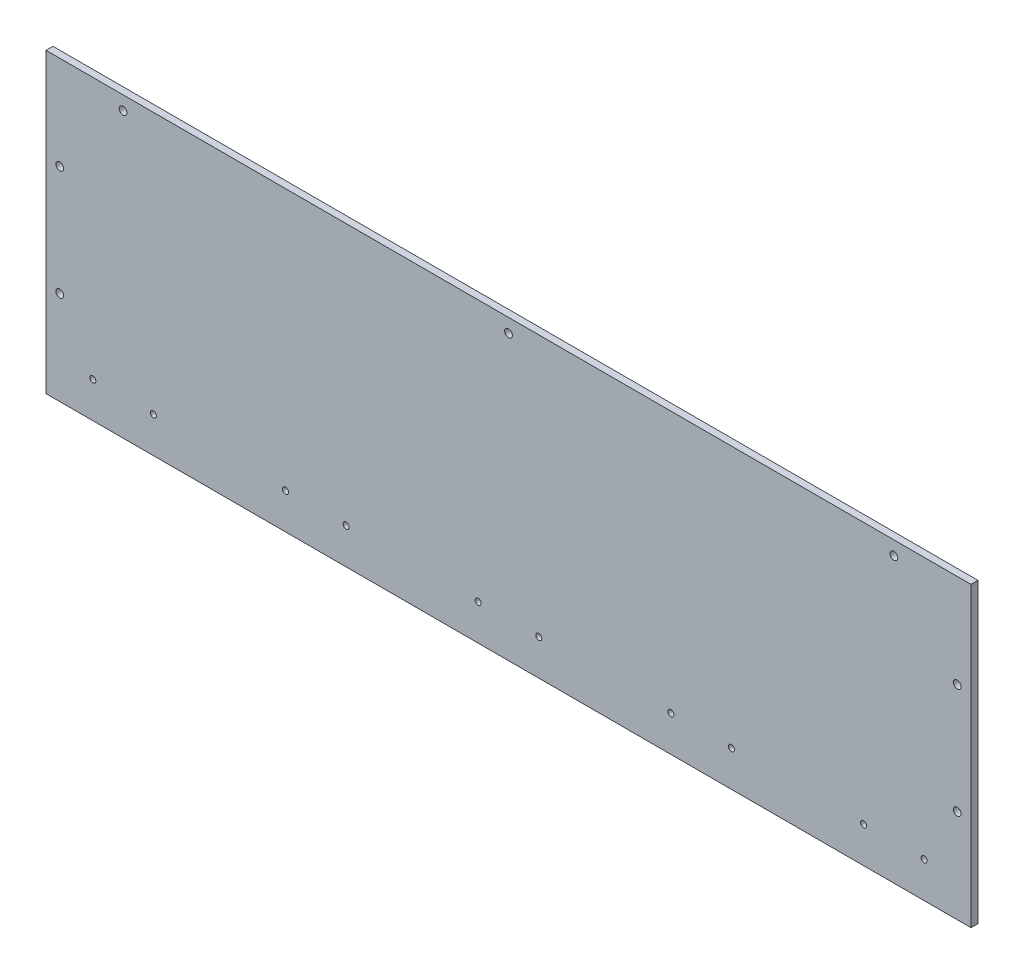
from build123d import *

# Parameters (mm, degrees)
SKETCH1_W           = 840
SKETCH1_H           = 270
BOSS_EXTRUDE1_DEPTH = 6.35
SKETCH2_R           = 3.5
SKETCH2_R_2         = 2.75
CUT_EXTRUDE1_DEPTH  = 883.349319997


with BuildPart() as part:
    # Sketch1 → Boss-Extrude1 (new body)
    with BuildSketch(Plane.XY):
        with Locations((420, 135)):
            Rectangle(SKETCH1_W, SKETCH1_H)
    extrude(amount=BOSS_EXTRUDE1_DEPTH)

    # Sketch2 → Cut-Extrude1 (cut, symmetric)
    with BuildSketch(Plane.XY.offset(6.35)):
        with Locations((70, 257.5)):
            Circle(SKETCH2_R)
        with Locations((420, 257.5)):
            Circle(SKETCH2_R)
        with Locations((770, 257.5)):
            Circle(SKETCH2_R)
        with Locations((12.5, 185)):
            Circle(SKETCH2_R)
        with Locations((12.5, 85)):
            Circle(SKETCH2_R)
        with Locations((392.5, 32.5)):
            Circle(SKETCH2_R_2)
        with Locations((447.5, 32.5)):
            Circle(SKETCH2_R_2)
        with Locations((567.5, 32.5)):
            Circle(SKETCH2_R_2)
        with Locations((622.5, 32.5)):
            Circle(SKETCH2_R_2)
        with Locations((742.5, 32.5)):
            Circle(SKETCH2_R_2)
        with Locations((797.5, 32.5)):
            Circle(SKETCH2_R_2)
        with Locations((217.5, 32.5)):
            Circle(SKETCH2_R_2)
        with Locations((272.5, 32.5)):
            Circle(SKETCH2_R_2)
        with Locations((42.5, 32.5)):
            Circle(SKETCH2_R_2)
        with Locations((97.5, 32.5)):
            Circle(SKETCH2_R_2)
    cut_extrude1 = extrude(amount=CUT_EXTRUDE1_DEPTH, both=True, mode=Mode.SUBTRACT)

    # Mirror1: Cut-Extrude1 across plane
    add(cut_extrude1.mirror(Plane.ZY.offset(-420)), mode=Mode.SUBTRACT)


solid = part.part
